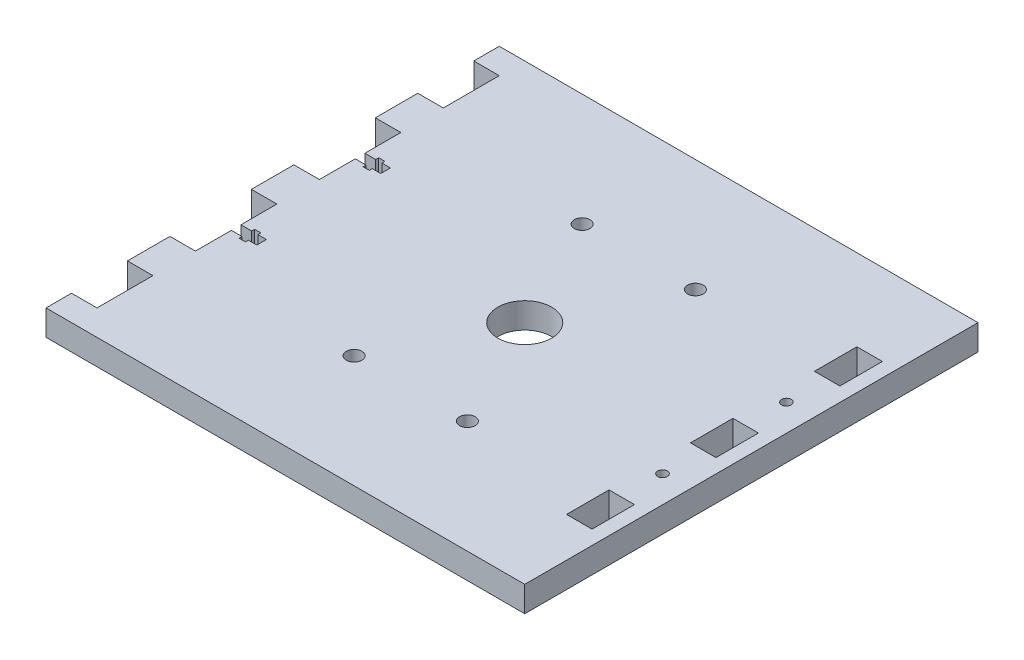
from build123d import *

# Parameters (mm, degrees)
SKETCH1_W           = 160
SKETCH1_H           = 160
BOSS_EXTRUDE1_DEPTH = 9
SKETCH2_W           = 9
SKETCH2_H           = 15
SKETCH2_H_2         = 9
BOSS_EXTRUDE2_DEPTH = 9
SKETCH3_R           = 1.7
SKETCH3_W           = 9
SKETCH3_H           = 15
CUT_EXTRUDE1_DEPTH  = 121.008333044
CUT_EXTRUDE2_DEPTH  = 121.008333044
SKETCH5_R           = 9.5
SKETCH5_R_2         = 2.75
CUT_EXTRUDE3_DEPTH  = 121.008333044


with BuildPart() as part:
    # Sketch1 → Boss-Extrude1 (new body)
    with BuildSketch(Plane(origin=(0, 0, 0), x_dir=(1, 0, 0), z_dir=(0, 1, 0))):
        Rectangle(SKETCH1_W, SKETCH1_H)
    extrude(amount=BOSS_EXTRUDE1_DEPTH)

    # Sketch2 → Boss-Extrude2 (add)
    with BuildSketch(Plane(origin=(0, 9, 0), x_dir=(1, 0, 0), z_dir=(0, 1, 0))):
        with Locations((-84.5, 0)):
            Rectangle(SKETCH2_W, SKETCH2_H)
        with Locations((-84.5, 43.75)):
            Rectangle(SKETCH2_W, SKETCH2_H)
        with Locations((-84.5, -43.75)):
            Rectangle(SKETCH2_W, SKETCH2_H)
        with Locations((-84.5, 75.5)):
            Rectangle(SKETCH2_W, SKETCH2_H_2)
        with Locations((-84.5, -75.5)):
            Rectangle(SKETCH2_W, SKETCH2_H_2)
    extrude(amount=-BOSS_EXTRUDE2_DEPTH)

    # Sketch3 → Cut-Extrude1 (cut, through all)
    with BuildSketch(Plane(origin=(0, 9, 0), x_dir=(1, 0, 0), z_dir=(0, 1, 0))):
        with Locations(Location((70.5, 21.875, 0), (0, 0, 270))):
            Circle(SKETCH3_R)
        with Locations(Location((70.5, -21.875, 0), (0, 0, 270))):
            Circle(SKETCH3_R)
        with Locations((70.5, 43.75)):
            Rectangle(SKETCH3_W, SKETCH3_H)
        with Locations((70.5, 0)):
            Rectangle(SKETCH3_W, SKETCH3_H)
        with Locations((70.5, -43.75)):
            Rectangle(SKETCH3_W, SKETCH3_H)
    extrude(amount=-CUT_EXTRUDE1_DEPTH, mode=Mode.SUBTRACT)

    # Sketch4 → Cut-Extrude2 (cut, through all)
    with BuildSketch(Plane(origin=(0, 9, 0), x_dir=(1, 0, 0), z_dir=(0, 1, 0))):
        Polygon((-80, 23.575), (-76.2, 23.575), (-76.2, 24.625), (-74, 24.625), (-74, 23.575), (-71, 23.575), (-71, 20.175), (-74, 20.175), (-74, 19.125), (-76.2, 19.125), (-76.2, 20.175), (-80, 20.175), align=None)
        Polygon((-80, -23.575), (-80, -20.175), (-76.2, -20.175), (-76.2, -19.125), (-74, -19.125), (-74, -20.175), (-71, -20.175), (-71, -23.575), (-74, -23.575), (-74, -24.625), (-76.2, -24.625), (-76.2, -23.575), align=None)
    extrude(amount=-CUT_EXTRUDE2_DEPTH, mode=Mode.SUBTRACT)

    # Sketch5 → Cut-Extrude3 (cut, through all)
    with BuildSketch(Plane(origin=(0, 9, 0), x_dir=(1, 0, 0), z_dir=(0, 1, 0))):
        with Locations(Location((0, 0, 0), (0, 0, 270))):
            Circle(SKETCH5_R)
        with Locations(Location((-20, 40.25, 0), (0, 0, 270))):
            Circle(SKETCH5_R_2)
        with Locations(Location((20, 40.25, 0), (0, 0, 270))):
            Circle(SKETCH5_R_2)
        with Locations(Location((20, -40.25, 0), (0, 0, 270))):
            Circle(SKETCH5_R_2)
        with Locations(Location((-20, -40.25, 0), (0, 0, 270))):
            Circle(SKETCH5_R_2)
    extrude(amount=-CUT_EXTRUDE3_DEPTH, mode=Mode.SUBTRACT)


solid = part.part
